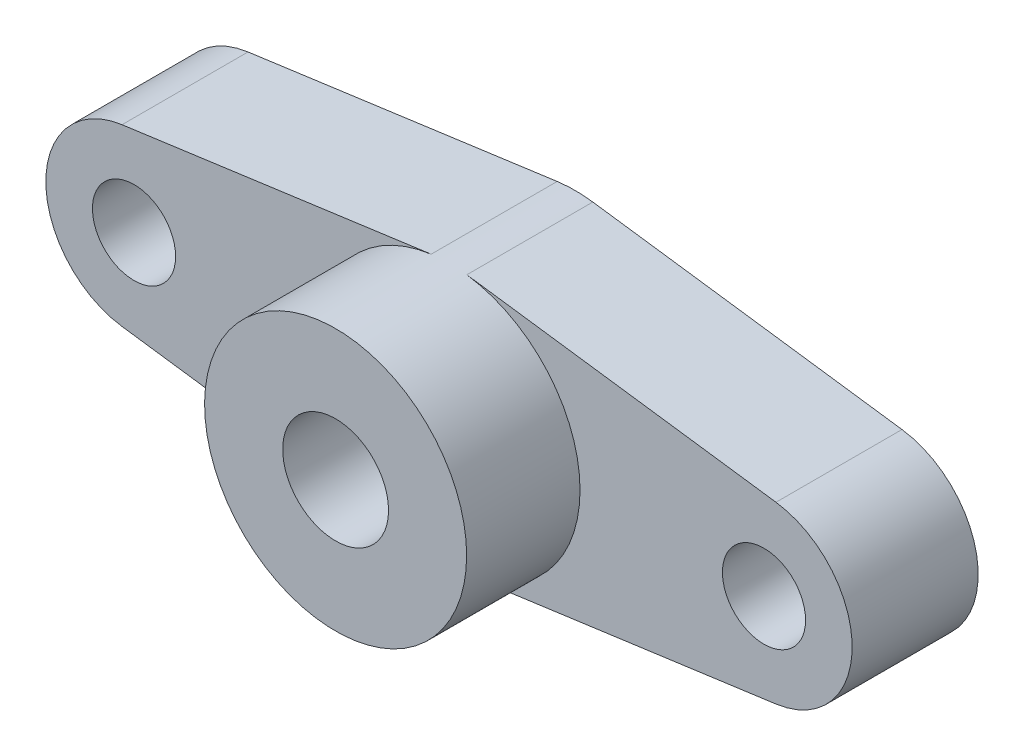
from build123d import *

# Parameters (mm, degrees)
SKETCH_1_W             = 32
SKETCH_1_H             = 10.4
SKETCH_1_R             = 0.5
EXTRUDE_1_DEPTH        = 5
SKETCH_2_R             = 5.2
SKETCH_2_R_2           = 0.5
EXTRUDE_2_DEPTH        = 4.5
CUT_EXTRUDE_START      = -5.3
CUT_EXTRUDE_1_DEPTH    = 5.3
HOLE_WIZARD_M4_1_D     = 3.3
HOLE_WIZARD_M4_1_DEPTH = 10.1
HOLE_WIZARD_M4_1_TIP   = 0.991420021
HOLE_WIZARD_M5_1_D     = 4.2
HOLE_WIZARD_M5_1_DEPTH = 22.4
HOLE_WIZARD_M5_1_TIP   = 1.2618073


with BuildPart() as part:
    # 草图1 → 凸台-拉伸1 (new body)
    with BuildSketch(Plane.XY):
        Rectangle(SKETCH_1_W, SKETCH_1_H)
        with Locations((-12.5, 0)):
            Circle(SKETCH_1_R, mode=Mode.SUBTRACT)
        with Locations((12.5, 0)):
            Circle(SKETCH_1_R, mode=Mode.SUBTRACT)
        Circle(SKETCH_1_R, mode=Mode.SUBTRACT)
    extrude(amount=EXTRUDE_1_DEPTH)

    # 草图2 → 凸台-拉伸2 (add)
    with BuildSketch(Plane.XY.offset(5)):
        with Locations(Location((0, 0, 0), (0, 0, 270))):
            Circle(SKETCH_2_R)
        Circle(SKETCH_2_R_2, mode=Mode.SUBTRACT)
    extrude(amount=EXTRUDE_2_DEPTH)

    # 草图3 → 切除-拉伸1 (cut)
    with BuildSketch(Plane.XY.offset(5).offset(CUT_EXTRUDE_START)):
        with BuildLine():
            Line((-12.976, 3.46748093), (-0.7072, 5.151685953))
            ThreePointArc((-0.7072, 5.151685953), (-0.354424212, 5.187907428), (0, 5.2))
            Line((0, 5.2), (-16, 5.2))
            Line((-16, 5.2), (-16, 0))
            ThreePointArc((-16, 0), (-15.137802115, 2.300434742), (-12.976, 3.46748093))
        make_face()
        with BuildLine():
            ThreePointArc((0, -5.2), (-0.354424212, -5.187907428), (-0.7072, -5.151685953))
            Line((-0.7072, -5.151685953), (-12.976, -3.46748093))
            ThreePointArc((-12.976, -3.46748093), (-15.137802115, -2.300434742), (-16, 0))
            Line((-16, 0), (-16, -5.2))
            Line((-16, -5.2), (0, -5.2))
        make_face()
        with BuildLine():
            ThreePointArc((0.7072, -5.151685953), (0.354424212, -5.187907428), (0, -5.2))
            Line((0, -5.2), (16, -5.2))
            Line((16, -5.2), (16, 0))
            ThreePointArc((16, 0), (15.137802115, -2.300434742), (12.976, -3.46748093))
            Line((12.976, -3.46748093), (0.7072, -5.151685953))
        make_face()
        with BuildLine():
            Line((16, 5.2), (0, 5.2))
            ThreePointArc((0, 5.2), (0.354424212, 5.187907428), (0.7072, 5.151685953))
            Line((0.7072, 5.151685953), (12.976, 3.46748093))
            ThreePointArc((12.976, 3.46748093), (15.137802115, 2.300434742), (16, 0))
            Line((16, 0), (16, 5.2))
        make_face()
    extrude(amount=CUT_EXTRUDE_1_DEPTH, mode=Mode.SUBTRACT)

    # M4 螺纹孔1
    with Locations(Plane.XY.offset(5)):
        with Locations((-12.5, 0), (12.5, 0)):
            Hole(HOLE_WIZARD_M4_1_D / 2, depth=HOLE_WIZARD_M4_1_DEPTH)
            with Locations((0, 0, -(HOLE_WIZARD_M4_1_DEPTH + HOLE_WIZARD_M4_1_TIP / 2))):  # 118° drill point
                Cone(0, HOLE_WIZARD_M4_1_D / 2, HOLE_WIZARD_M4_1_TIP, mode=Mode.SUBTRACT)

    # M5 螺纹孔1
    with Locations(Plane.XY.offset(9.5)):
        with Locations((0, 0)):
            Hole(HOLE_WIZARD_M5_1_D / 2, depth=HOLE_WIZARD_M5_1_DEPTH)
            with Locations((0, 0, -(HOLE_WIZARD_M5_1_DEPTH + HOLE_WIZARD_M5_1_TIP / 2))):  # 118° drill point
                Cone(0, HOLE_WIZARD_M5_1_D / 2, HOLE_WIZARD_M5_1_TIP, mode=Mode.SUBTRACT)


solid = part.part
